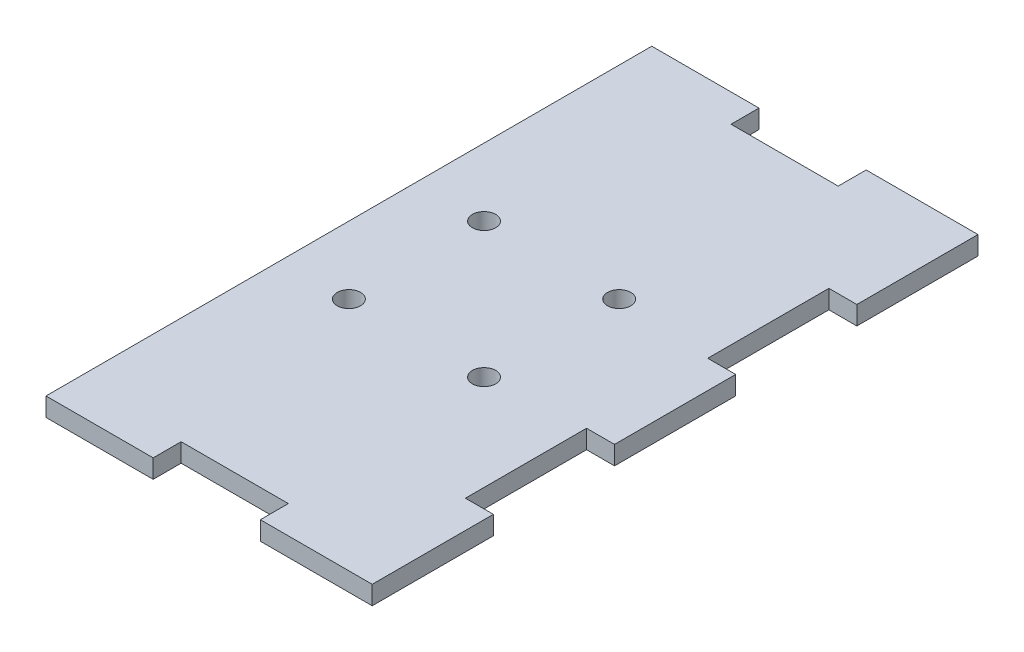
from build123d import *

# Parameters (mm, degrees)
SKETCH1_W           = 70
SKETCH1_H           = 130
BOSS_EXTRUDE1_DEPTH = 4
CUT_EXTRUDE1_DEPTH  = 148.702403501
SKETCH3_W           = 23
SKETCH3_H           = 6
SKETCH3_W_2         = 6
SKETCH3_H_2         = 26
CUT_EXTRUDE2_DEPTH  = 148.702403501


with BuildPart() as part:
    # Sketch1 → Boss-Extrude1 (new body)
    with BuildSketch(Plane(origin=(0, 0, 0), x_dir=(1, 0, 0), z_dir=(0, 1, 0))):
        with Locations((35, 65)):
            Rectangle(SKETCH1_W, SKETCH1_H)
    extrude(amount=BOSS_EXTRUDE1_DEPTH)

    # Sketch2 → Cut-Extrude1 (cut, through all)
    with BuildSketch(Plane(origin=(0, 4, 0), x_dir=(1, 0, 0), z_dir=(0, 1, 0))):
        with BuildLine():
            ThreePointArc((17, 79.5), (12.732233047, 81.267766953), (14.5, 77))
            Line((14.5, 77), (14.5, 79.5))
            Line((14.5, 79.5), (17, 79.5))
        make_face()
        with BuildLine():
            Line((14.5, 79.5), (14.5, 77))
            ThreePointArc((14.5, 77), (16.267766953, 77.732233047), (17, 79.5))
            Line((17, 79.5), (14.5, 79.5))
        make_face()
        with BuildLine():
            Line((14.5, 53), (14.5, 50.5))
            Line((14.5, 50.5), (17, 50.5))
            ThreePointArc((17, 50.5), (16.267766953, 52.267766953), (14.5, 53))
        make_face()
        with BuildLine():
            Line((17, 50.5), (14.5, 50.5))
            Line((14.5, 50.5), (14.5, 53))
            ThreePointArc((14.5, 53), (12.732233047, 48.732233047), (17, 50.5))
        make_face()
        with BuildLine():
            ThreePointArc((43.5, 53), (41.732233047, 52.267766953), (41, 50.5))
            Line((41, 50.5), (43.5, 50.5))
            Line((43.5, 50.5), (43.5, 53))
        make_face()
        with BuildLine():
            Line((43.5, 50.5), (41, 50.5))
            ThreePointArc((41, 50.5), (43.5, 48), (46, 50.5))
            ThreePointArc((46, 50.5), (45.267766953, 52.267766953), (43.5, 53))
            Line((43.5, 53), (43.5, 50.5))
        make_face()
        with BuildLine():
            ThreePointArc((41, 79.5), (41.732233047, 77.732233047), (43.5, 77))
            Line((43.5, 77), (43.5, 79.5))
            Line((43.5, 79.5), (41, 79.5))
        make_face()
        with BuildLine():
            Line((43.5, 79.5), (43.5, 77))
            ThreePointArc((43.5, 77), (45.267766953, 77.732233047), (46, 79.5))
            ThreePointArc((46, 79.5), (43.5, 82), (41, 79.5))
            Line((41, 79.5), (43.5, 79.5))
        make_face()
    extrude(amount=-CUT_EXTRUDE1_DEPTH, mode=Mode.SUBTRACT)

    # Sketch3 → Cut-Extrude2 (cut, through all)
    with BuildSketch(Plane(origin=(0, 4, 0), x_dir=(1, 0, 0), z_dir=(0, 1, 0))):
        with Locations((34.5, 3)):
            Rectangle(SKETCH3_W, SKETCH3_H)
        with Locations((67, 39)):
            Rectangle(SKETCH3_W_2, SKETCH3_H_2)
        with Locations((67, 91)):
            Rectangle(SKETCH3_W_2, SKETCH3_H_2)
        with Locations((34.5, 127)):
            Rectangle(SKETCH3_W, SKETCH3_H)
    extrude(amount=-CUT_EXTRUDE2_DEPTH, mode=Mode.SUBTRACT)


solid = part.part
